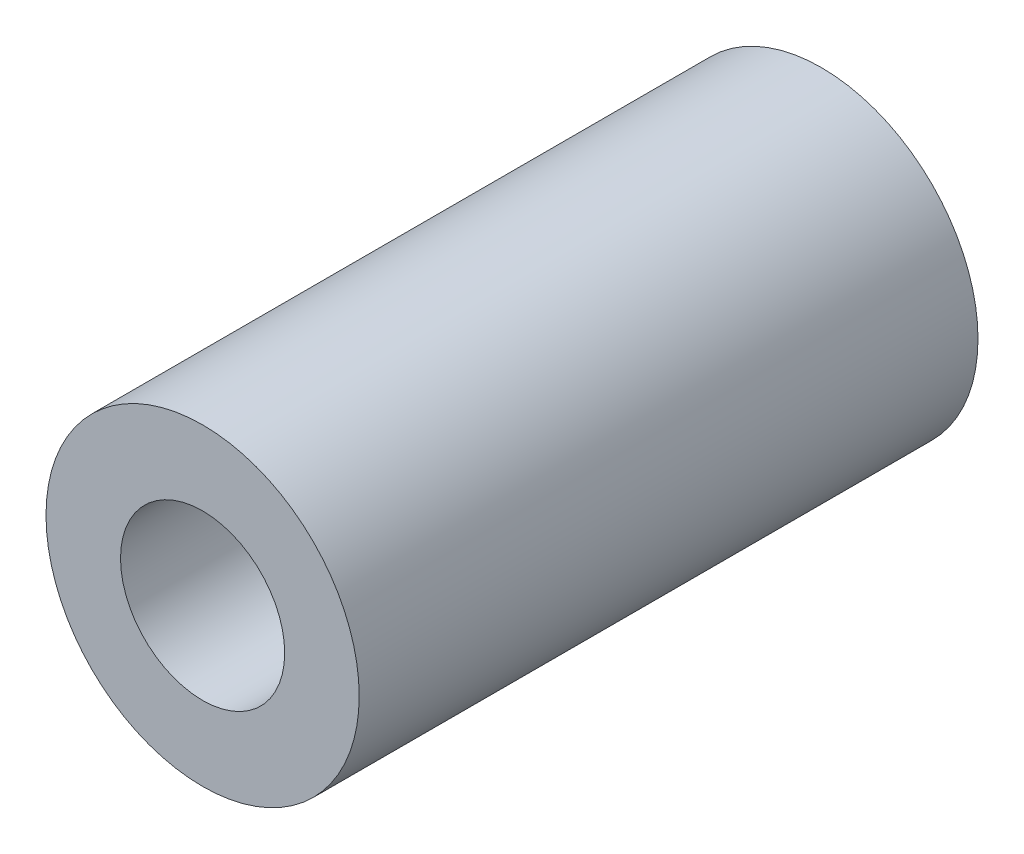
from build123d import *

# Parameters (mm, degrees)
SKETCH1_R      = 1.5748
SKETCH1_R_2    = 0.8255
EXTRUDE1_DEPTH = 6.223


with BuildPart() as part:
    # Sketch1 → Extrude1 (new body)
    with BuildSketch(Plane.XY):
        Circle(SKETCH1_R)
        Circle(SKETCH1_R_2, mode=Mode.SUBTRACT)
    extrude(amount=EXTRUDE1_DEPTH)


solid = part.part
